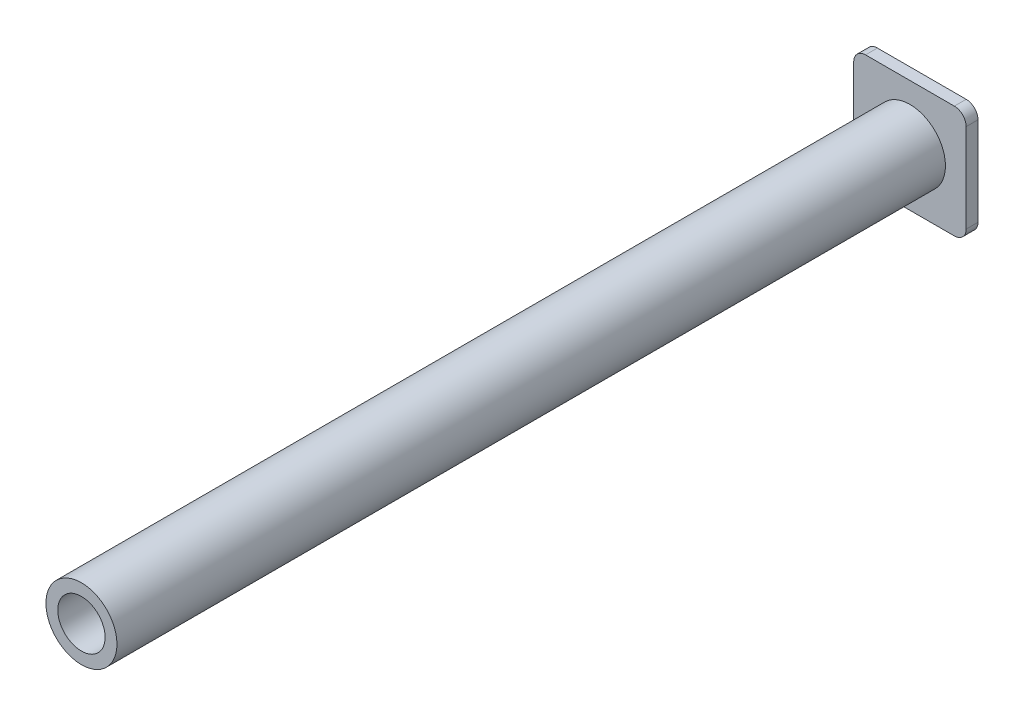
from build123d import *

# Parameters (mm, degrees)
PLATE_SKETCH_W      = 95
PLATE_SKETCH_H      = 95
PLATE_EXTRUDE_DEPTH = 10
PLATE_FILLET_R      = 10
POLE_SKETCH_R       = 30
POLE_SKETCH_R_2     = 20
POLE_EXTRUDE_DEPTH  = 700


with BuildPart() as part:
    # Plate Sketch → Plate Extrude (new body)
    with BuildSketch(Plane.XY):
        Rectangle(PLATE_SKETCH_W, PLATE_SKETCH_H)
    extrude(amount=PLATE_EXTRUDE_DEPTH)

    # Plate Fillet
    plate_fillet_edges = [part.edges().sort_by_distance(p)[0] for p in [
        (47.5, -47.5, 5),
        (-47.5, -47.5, 5),
        (-47.5, 47.5, 5),
        (47.5, 47.5, 5),
    ]]
    fillet(plate_fillet_edges, radius=PLATE_FILLET_R)

    # Pole Sketch → Pole Extrude (add)
    with BuildSketch(Plane.XY.offset(10)):
        Circle(POLE_SKETCH_R)
        Circle(POLE_SKETCH_R_2, mode=Mode.SUBTRACT)
    extrude(amount=POLE_EXTRUDE_DEPTH)


solid = part.part
